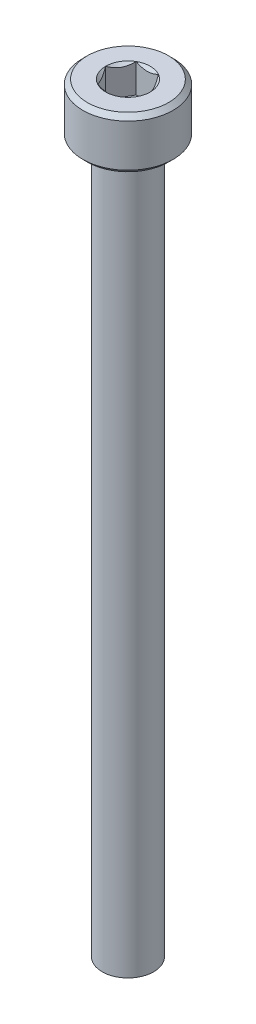
from build123d import *

# Parameters (mm, degrees)
SKETCH1_R           = 3.5
BOSS_EXTRUDE1_DEPTH = 4
CUT_EXTRUDE1_DEPTH  = 2.25
CHAMFER1_SIZE       = 0.35
SKETCH_1_R          = 2
EXTRUDE_1_DEPTH     = 55


with BuildPart() as part:
    # Sketch1 → Boss-Extrude1 (new body)
    with BuildSketch(Plane(origin=(0, 0, 0), x_dir=(1, 0, 0), z_dir=(0, 1, 0))):
        with Locations(Location((0, 0, 0), (0, 0, 270))):
            Circle(SKETCH1_R)
    extrude(amount=BOSS_EXTRUDE1_DEPTH)

    # Sketch2 → Cut-Extrude1 (cut)
    with BuildSketch(Plane(origin=(0, 4, 0), x_dir=(1, 0, 0), z_dir=(0, 1, 0))):
        Polygon((0.866025404, 1.5), (-0.866025404, 1.5), (-1.732050808, 0), (-0.866025404, -1.5), (0.866025404, -1.5), (1.732050808, 0), align=None)
    extrude(amount=-CUT_EXTRUDE1_DEPTH, mode=Mode.SUBTRACT)

    # Cut-Extrude2 cone 1 section (through the dimple's axis) → Cut-Extrude2 (revolve, cut)
    with BuildSketch(Plane(origin=(0, 4, 0), x_dir=(0, 0, 1), z_dir=(1, 0, 0))):
        Polygon((0, 0), (1.732050808, 0), (0, 1.732050808), align=None)
    revolve(axis=Axis((0, 4, 0), (0, -1, 0)), mode=Mode.SUBTRACT)

    # Chamfer1
    chamfer1_edges = [part.edges().sort_by_distance(p)[0] for p in [
        (0, 0, -3.5),
        (0, 4, -3.5),
    ]]
    chamfer(chamfer1_edges, length=CHAMFER1_SIZE)

    # 草图1 → 凸台-拉伸1 (add)
    with BuildSketch(Plane(origin=(0, 0, 0), x_dir=(-1, 0, 0), z_dir=(0, -1, 0))):
        with Locations(Location((0, 0, 0), (0, 0, 90))):
            Circle(SKETCH_1_R)
    extrude(amount=EXTRUDE_1_DEPTH)


solid = part.part
